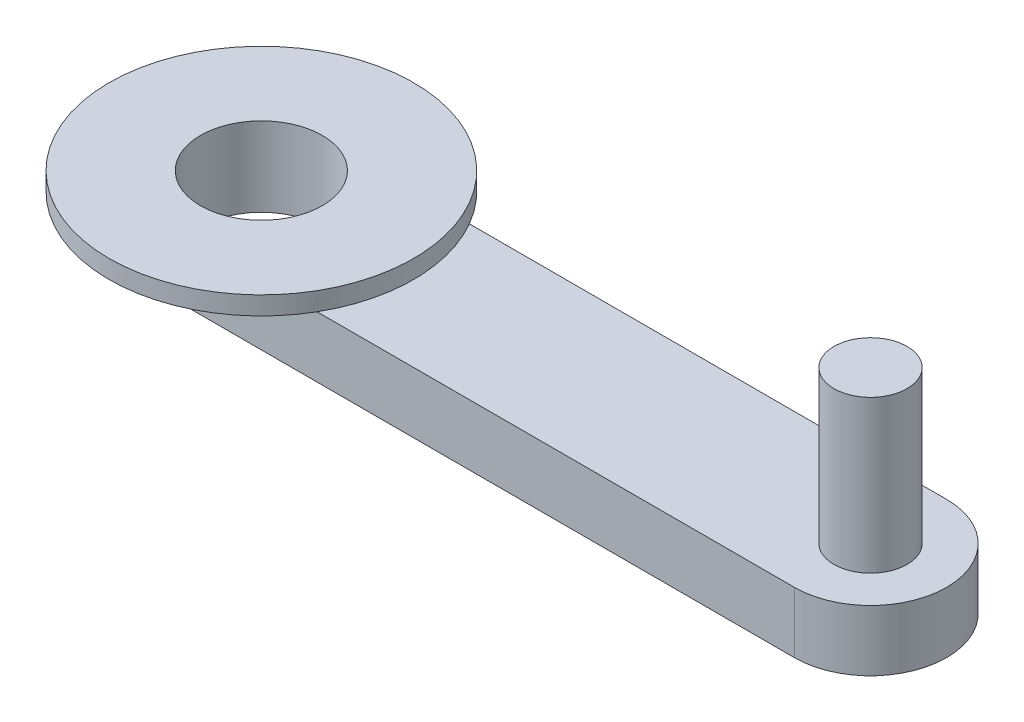
from build123d import *

# Parameters (mm, degrees)
BOSS_EXTRUDE1_DEPTH = 2.54
SKETCH2_R           = 1.524
BOSS_EXTRUDE2_DEPTH = 6.35
SKETCH3_R           = 2.54
CUT_EXTRUDE1_DEPTH  = 30.443738723
BOSS_EXTRUDE3_START = 0.762
SKETCH4_R           = 6.35
SKETCH4_R_2         = 2.54
BOSS_EXTRUDE3_DEPTH = 0.762


with BuildPart() as part:
    # Sketch1 → Boss-Extrude1 (new body)
    with BuildSketch(Plane(origin=(0, 0, 0), x_dir=(1, 0, 0), z_dir=(0, 1, 0))):
        with BuildLine():
            Line((0, -3.175), (-25.4, -3.175))
            ThreePointArc((-25.4, -3.175), (-28.575, 0), (-25.4, 3.175))
            Line((-25.4, 3.175), (0, 3.175))
            ThreePointArc((0, 3.175), (3.175, 0), (0, -3.175))
        make_face()
    extrude(amount=BOSS_EXTRUDE1_DEPTH)

    # Sketch2 → Boss-Extrude2 (add)
    with BuildSketch(Plane(origin=(0, 2.54, 0), x_dir=(1, 0, 0), z_dir=(0, 1, 0))):
        with Locations(Location((0, 0, 0), (0, 0, 270))):
            Circle(SKETCH2_R)
    extrude(amount=BOSS_EXTRUDE2_DEPTH)

    # Sketch3 → Cut-Extrude1 (cut, through all)
    with BuildSketch(Plane(origin=(0, 2.54, 0), x_dir=(1, 0, 0), z_dir=(0, 1, 0))):
        with Locations(Location((-25.4, 0, 0), (0, 0, 270))):
            Circle(SKETCH3_R)
    extrude(amount=-CUT_EXTRUDE1_DEPTH, mode=Mode.SUBTRACT)

    # Sketch4 → Boss-Extrude3 (add)
    with BuildSketch(Plane(origin=(0, 2.54, 0), x_dir=(1, 0, 0), z_dir=(0, 1, 0)).offset(BOSS_EXTRUDE3_START)):
        with Locations(Location((-25.4, 0, 0), (0, 0, 30))):
            Circle(SKETCH4_R)
        with Locations(Location((-25.4, 0, 0), (0, 0, 270))):
            Circle(SKETCH4_R_2, mode=Mode.SUBTRACT)
    extrude(amount=-BOSS_EXTRUDE3_DEPTH)


solid = part.part
